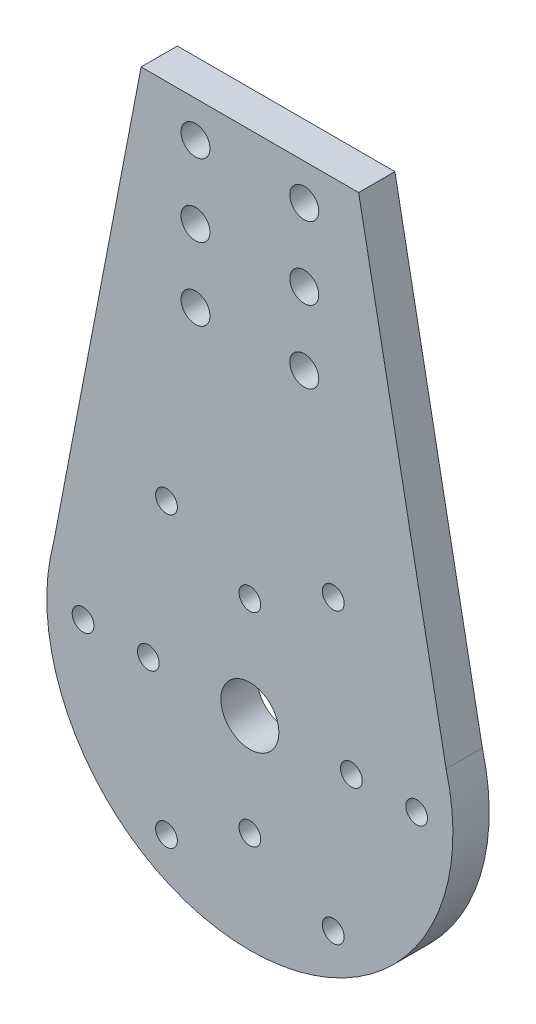
from build123d import *

# Parameters (mm, degrees)
SKETCH1_R           = 1.5
SKETCH1_R_2         = 4
SKETCH1_R_3         = 2
BOSS_EXTRUDE1_DEPTH = 5


with BuildPart() as part:
    # Sketch1 → Boss-Extrude1 (new body)
    with BuildSketch(Plane.XY):
        with BuildLine():
            Line((-15, 70), (-27.062163807, 7.186048295))
            ThreePointArc((-27.062163807, 7.186048295), (0, -28), (27.062163807, 7.186048295))
            Line((27.062163807, 7.186048295), (15, 70))
            Line((15, 70), (-15, 70))
        make_face()
        with Locations((-23, 0)):
            Circle(SKETCH1_R, mode=Mode.SUBTRACT)
        with Locations((-14, 0)):
            Circle(SKETCH1_R, mode=Mode.SUBTRACT)
        with Locations((-11.5, -19.918584287)):
            Circle(SKETCH1_R, mode=Mode.SUBTRACT)
        with Locations((0, -14)):
            Circle(SKETCH1_R, mode=Mode.SUBTRACT)
        with Locations((-11.5, 19.918584287)):
            Circle(SKETCH1_R, mode=Mode.SUBTRACT)
        with BuildLine():
            ThreePointArc((0, 12.5), (-1.5, 14), (0, 15.5))
            ThreePointArc((0, 15.5), (1.5, 14), (0, 12.5))
        make_face(mode=Mode.SUBTRACT)
        with Locations((11.5, -19.918584287)):
            Circle(SKETCH1_R, mode=Mode.SUBTRACT)
        Circle(SKETCH1_R_2, mode=Mode.SUBTRACT)
        with Locations((14, 0)):
            Circle(SKETCH1_R, mode=Mode.SUBTRACT)
        with Locations((23, 0)):
            Circle(SKETCH1_R, mode=Mode.SUBTRACT)
        with Locations((11.5, 19.918584287)):
            Circle(SKETCH1_R, mode=Mode.SUBTRACT)
        with Locations((-7.5, 45)):
            Circle(SKETCH1_R_3, mode=Mode.SUBTRACT)
        with Locations((-7.5, 55)):
            Circle(SKETCH1_R_3, mode=Mode.SUBTRACT)
        with Locations((-7.5, 65)):
            Circle(SKETCH1_R_3, mode=Mode.SUBTRACT)
        with Locations((7.5, 65)):
            Circle(SKETCH1_R_3, mode=Mode.SUBTRACT)
        with Locations((7.5, 55)):
            Circle(SKETCH1_R_3, mode=Mode.SUBTRACT)
        with Locations((7.5, 45)):
            Circle(SKETCH1_R_3, mode=Mode.SUBTRACT)
    extrude(amount=BOSS_EXTRUDE1_DEPTH)


solid = part.part
